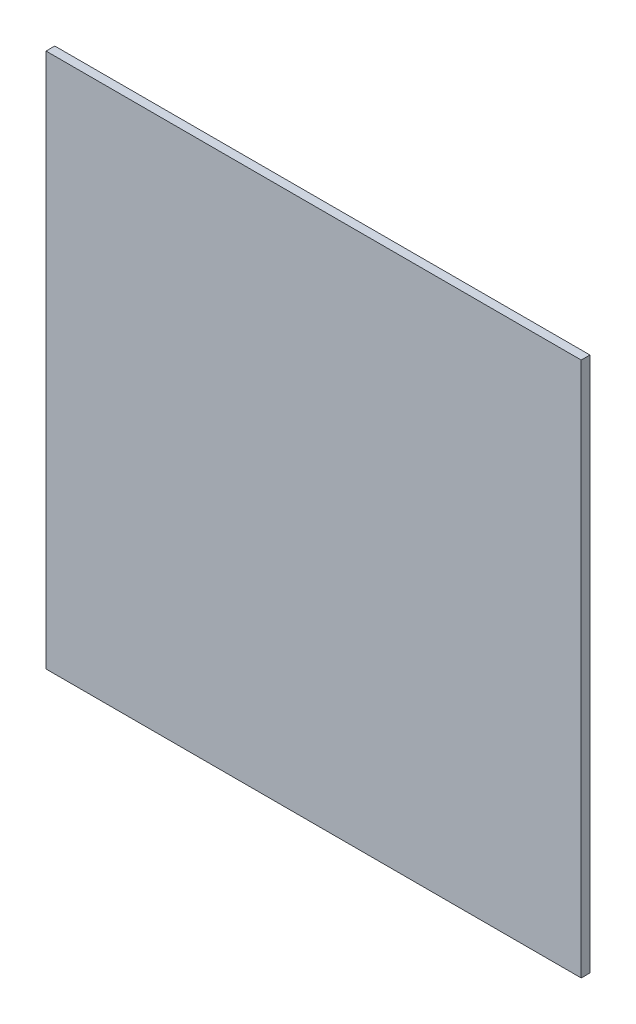
from build123d import *

# Parameters (mm, degrees)
SKETCH1_W           = 98
SKETCH1_H           = 98
BOSS_EXTRUDE1_DEPTH = 1.6


with BuildPart() as part:
    # Sketch1 → Boss-Extrude1 (new body)
    with BuildSketch(Plane.XY):
        with Locations((49, 49)):
            Rectangle(SKETCH1_W, SKETCH1_H)
    extrude(amount=BOSS_EXTRUDE1_DEPTH)


solid = part.part
